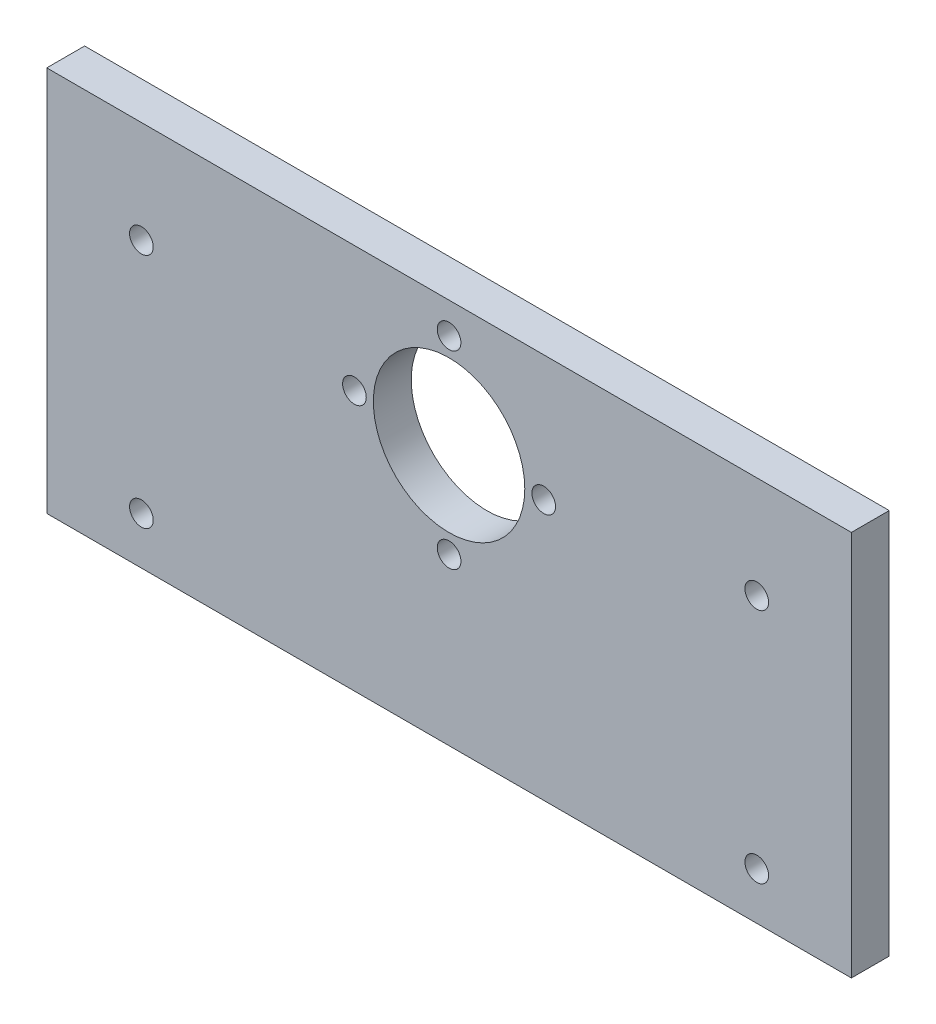
from build123d import *

# Parameters (mm, degrees)
SKETCH1_W           = 170.035665534
SKETCH1_H           = 166.614386528
SKETCH1_R           = 16
BOSS_EXTRUDE1_DEPTH = 8
SKETCH2_R           = 2.5
SKETCH2_W           = 170.035665534
SKETCH2_H           = 56.759468899
SKETCH2_H_2         = 28.307193264
CUT_EXTRUDE1_DEPTH  = 120.298450693


with BuildPart() as part:
    # Sketch1 → Boss-Extrude1 (new body)
    with BuildSketch(Plane.XY):
        Rectangle(SKETCH1_W, SKETCH1_H)
        Circle(SKETCH1_R, mode=Mode.SUBTRACT)
    extrude(amount=BOSS_EXTRUDE1_DEPTH)

    # Sketch2 → Cut-Extrude1 (cut, through all)
    with BuildSketch(Plane.XY.offset(8)):
        with Locations((-65.017832767, 5)):
            Circle(SKETCH2_R)
        with Locations((-65.017832767, -45)):
            Circle(SKETCH2_R)
        with Locations((65.017832767, 5)):
            Circle(SKETCH2_R)
        with Locations((65.017832767, -45)):
            Circle(SKETCH2_R)
        with Locations((0, 20)):
            Circle(SKETCH2_R)
        with Locations((-20, 0)):
            Circle(SKETCH2_R)
        with Locations((0, -20)):
            Circle(SKETCH2_R)
        with Locations((20, 0)):
            Circle(SKETCH2_R)
        with Locations((0, 54.927458814)):
            Rectangle(SKETCH2_W, SKETCH2_H)
        with Locations((0, -69.153596632)):
            Rectangle(SKETCH2_W, SKETCH2_H_2)
    extrude(amount=-CUT_EXTRUDE1_DEPTH, mode=Mode.SUBTRACT)


solid = part.part
